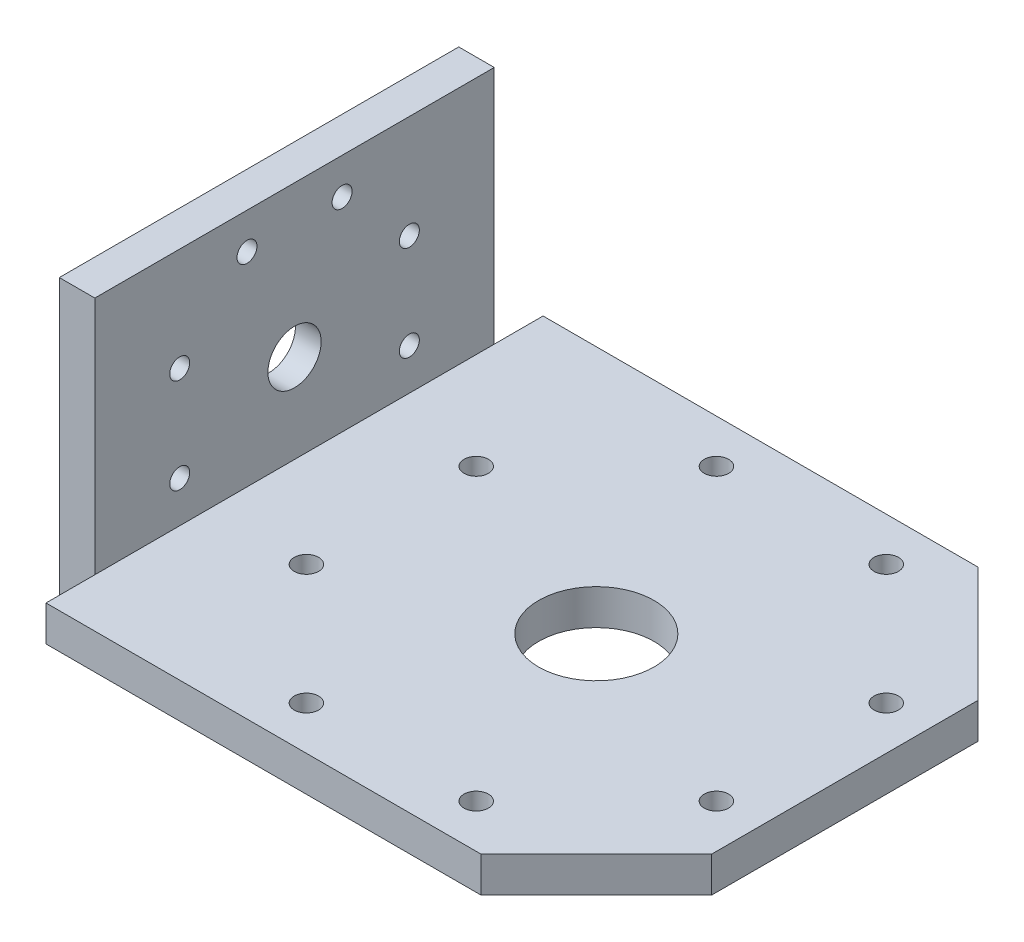
from build123d import *

# Parameters (mm, degrees)
SK_BACK_PLATE_W         = 90
SK_BACK_PLATE_H         = 70
SK_BACK_PLATE_R         = 2.25
SK_BACK_PLATE_R_2       = 6
BACK_PLATE_DEPTH        = 8
SK_ROLL_PILOT_RECESS_R  = 22.15
ROLL_PILOT_RECESS_DEPTH = 2.2
SK_MEDIAL_PLATE_R       = 2.75
SK_MEDIAL_PLATE_R_2     = 13
MEDIAL_PLATE_DEPTH      = 8


with BuildPart() as part:
    # SK_Back_Plate → Back_Plate (new body)
    with BuildSketch(Plane(origin=(-76, 0, 0), x_dir=(0, 0, -1), z_dir=(1, 0, 0))):
        with Locations((0, -1)):
            Rectangle(SK_BACK_PLATE_W, SK_BACK_PLATE_H)
        with Locations((25.86862691, 10.715136106)):
            Circle(SK_BACK_PLATE_R, mode=Mode.SUBTRACT)
        with Locations((10.715136106, 25.86862691)):
            Circle(SK_BACK_PLATE_R, mode=Mode.SUBTRACT)
        with Locations((-10.715136106, 25.86862691)):
            Circle(SK_BACK_PLATE_R, mode=Mode.SUBTRACT)
        with Locations((-25.86862691, 10.715136106)):
            Circle(SK_BACK_PLATE_R, mode=Mode.SUBTRACT)
        with Locations((-25.86862691, -10.715136106)):
            Circle(SK_BACK_PLATE_R, mode=Mode.SUBTRACT)
        with Locations((-10.715136106, -25.86862691)):
            Circle(SK_BACK_PLATE_R, mode=Mode.SUBTRACT)
        with Locations((10.715136106, -25.86862691)):
            Circle(SK_BACK_PLATE_R, mode=Mode.SUBTRACT)
        with Locations((25.86862691, -10.715136106)):
            Circle(SK_BACK_PLATE_R, mode=Mode.SUBTRACT)
        Circle(SK_BACK_PLATE_R_2, mode=Mode.SUBTRACT)
    extrude(amount=BACK_PLATE_DEPTH)

    # SK_Roll_Pilot_Recess → Roll_Pilot_Recess (cut)
    with BuildSketch(Plane(origin=(-76, 0, 0), x_dir=(0, 0, -1), z_dir=(1, 0, 0))):
        Circle(SK_ROLL_PILOT_RECESS_R)
    extrude(amount=ROLL_PILOT_RECESS_DEPTH, mode=Mode.SUBTRACT)

    # SK_Medial_Plate → Medial_Plate (add)
    with BuildSketch(Plane(origin=(0, -28, 0), x_dir=(1, 0, 0), z_dir=(0, 1, 0))):
        Polygon((-68, 56), (30, 56), (56, 30), (56, -30), (30, -56), (-68, -56), align=None)
        with Locations(Location((46.193976626, 19.134171618, 0), (0, 0, 270))):
            Circle(SK_MEDIAL_PLATE_R, mode=Mode.SUBTRACT)
        with Locations(Location((19.134171618, 46.193976626, 0), (0, 0, 270))):
            Circle(SK_MEDIAL_PLATE_R, mode=Mode.SUBTRACT)
        with Locations(Location((-19.134171618, 46.193976626, 0), (0, 0, 270))):
            Circle(SK_MEDIAL_PLATE_R, mode=Mode.SUBTRACT)
        with Locations(Location((-46.193976626, 19.134171618, 0), (0, 0, 270))):
            Circle(SK_MEDIAL_PLATE_R, mode=Mode.SUBTRACT)
        with Locations(Location((-46.193976626, -19.134171618, 0), (0, 0, 270))):
            Circle(SK_MEDIAL_PLATE_R, mode=Mode.SUBTRACT)
        with Locations(Location((-19.134171618, -46.193976626, 0), (0, 0, 270))):
            Circle(SK_MEDIAL_PLATE_R, mode=Mode.SUBTRACT)
        with Locations(Location((19.134171618, -46.193976626, 0), (0, 0, 270))):
            Circle(SK_MEDIAL_PLATE_R, mode=Mode.SUBTRACT)
        with Locations(Location((46.193976626, -19.134171618, 0), (0, 0, 270))):
            Circle(SK_MEDIAL_PLATE_R, mode=Mode.SUBTRACT)
        with Locations(Location((0, 0, 0), (0, 0, 270))):
            Circle(SK_MEDIAL_PLATE_R_2, mode=Mode.SUBTRACT)
    extrude(amount=MEDIAL_PLATE_DEPTH)


solid = part.part
